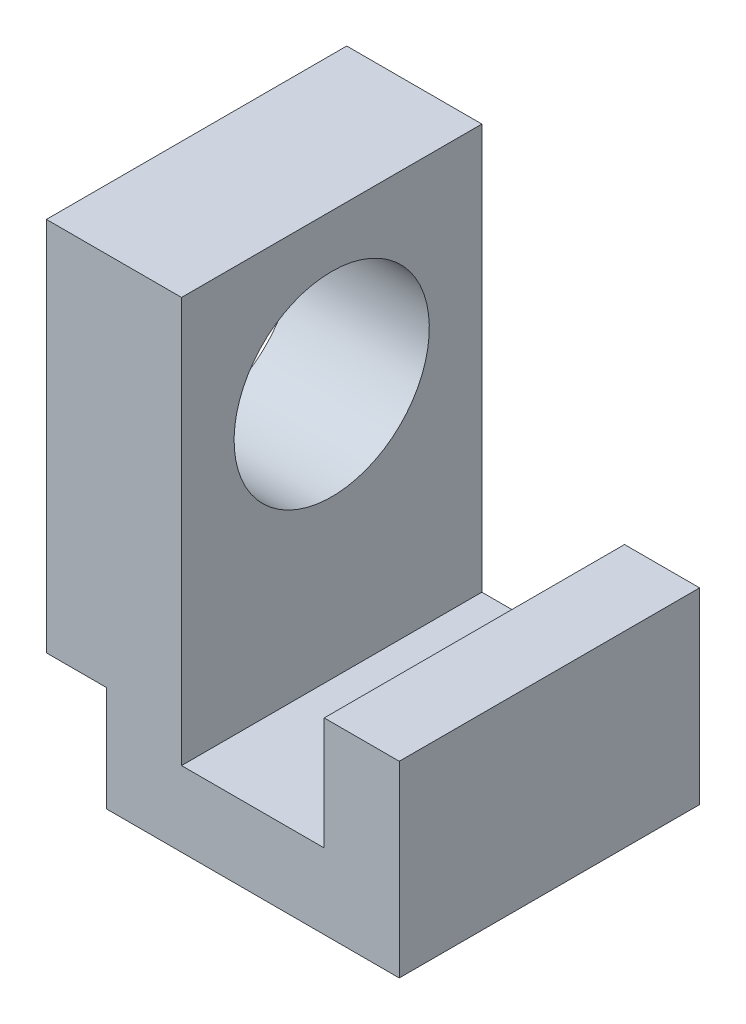
from build123d import *

# Parameters (mm, degrees)
BOSS_EXTRUDE1_DEPTH = 20
SKETCH2_R           = 13
CUT_EXTRUDE1_DEPTH  = 40


with BuildPart() as part:
    # Sketch1 → Boss-Extrude1 (new, symmetric)
    with BuildSketch(Plane.XY):
        Polygon((0, 0), (0, 14), (-8, 14), (-8, 64), (10, 64), (10, 10), (29, 10), (29, 25), (39, 25), (39, 0), align=None)
    extrude(amount=BOSS_EXTRUDE1_DEPTH, both=True)

    # Sketch2 → Cut-Extrude1 (cut)
    with BuildSketch(Plane(origin=(10, 0, 0), x_dir=(0, 0, -1), z_dir=(1, 0, 0))):
        with Locations(Location((0, 44, 0), (0, 0, 90))):
            Circle(SKETCH2_R)
    extrude(amount=-CUT_EXTRUDE1_DEPTH, mode=Mode.SUBTRACT)


solid = part.part
